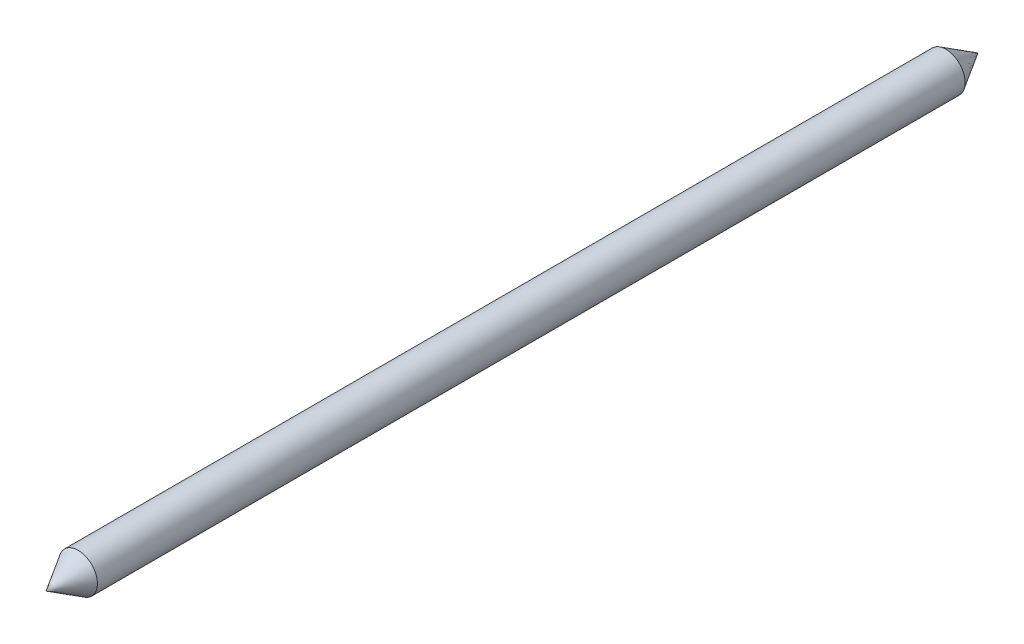
from build123d import *


with BuildPart() as part:
    # Sketch1 → Revolve1 (revolve)
    with BuildSketch(Plane(origin=(0, 0, 0), x_dir=(1, 0, 0), z_dir=(0, 1, 0)), mode=Mode.PRIVATE) as revolve1_sk:
        Polygon((0, 184.15), (0, -184.15), (7.62, -171.45), (7.62, 171.45), align=None)
    revolve(revolve1_sk.sketch.rotate(Axis((0, 0, -184.15), (0, 0, 1)), 180), axis=Axis((0, 0, -184.15), (0, 0, 1)))


solid = part.part
